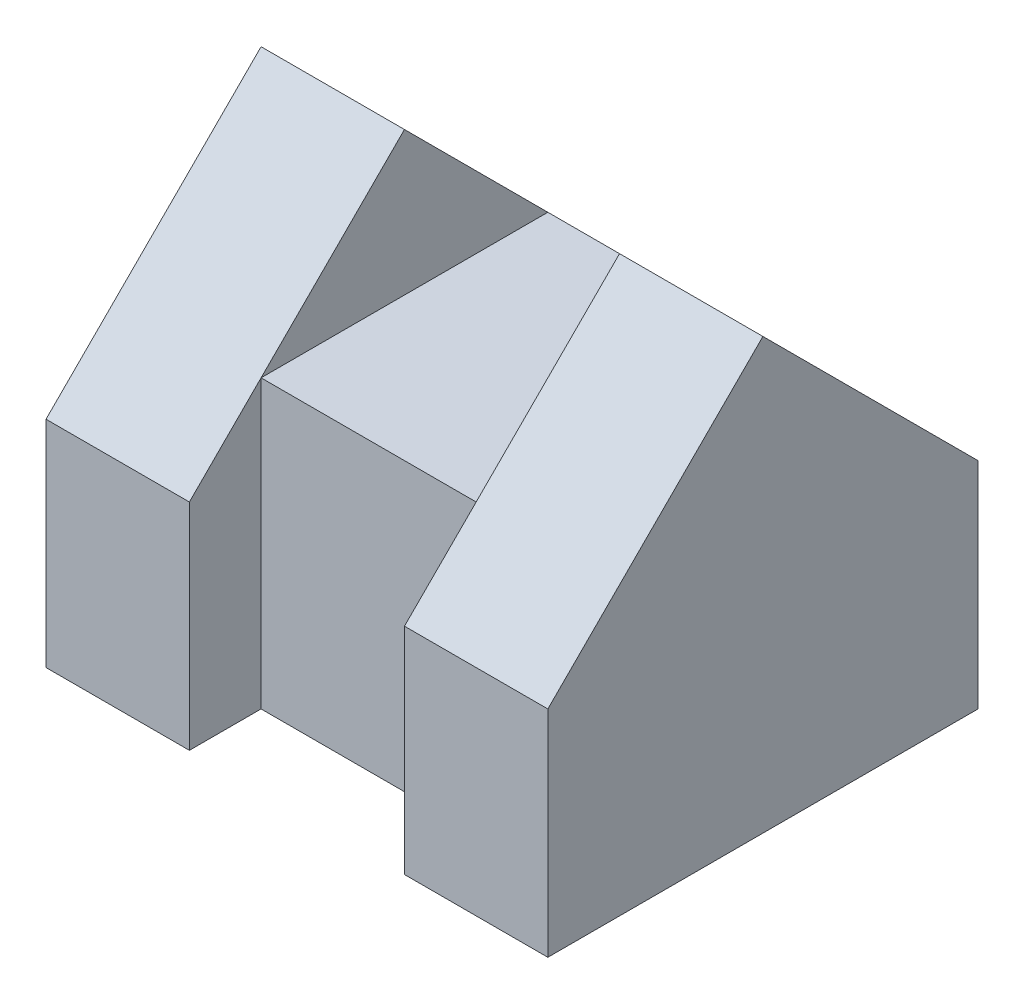
from build123d import *

# Parameters (mm, degrees)
SKETCH2_W           = 177.8
SKETCH2_H           = 152.4
BOSS_EXTRUDE1_DEPTH = 76.2
SKETCH10_W          = 76.2
SKETCH10_H          = 50.8
CUT_EXTRUDE2_DEPTH  = 193.18587357
SKETCH12_W          = 76.2
SKETCH12_H          = 25.4
CUT_EXTRUDE3_DEPTH  = 156.02325632
CUT_EXTRUDE4_DEPTH  = 208.907960406


with BuildPart() as part:
    # Sketch2 → Boss-Extrude1 (new, symmetric)
    with BuildSketch(Plane.XY):
        Rectangle(SKETCH2_W, SKETCH2_H)
    extrude(amount=BOSS_EXTRUDE1_DEPTH, both=True)

    # Sketch10 → Cut-Extrude2 (cut, through all)
    with BuildSketch(Plane.XY.offset(76.2)):
        with Locations((0, 50.8)):
            Rectangle(SKETCH10_W, SKETCH10_H)
    extrude(amount=-CUT_EXTRUDE2_DEPTH, mode=Mode.SUBTRACT)

    # Sketch12 → Cut-Extrude3 (cut, through all)
    with BuildSketch(Plane(origin=(0, 25.4, 0), x_dir=(1, 0, 0), z_dir=(0, 1, 0))):
        with Locations((0, -63.5)):
            Rectangle(SKETCH12_W, SKETCH12_H)
        with Locations((0, 63.5)):
            Rectangle(SKETCH12_W, SKETCH12_H)
    extrude(amount=-CUT_EXTRUDE3_DEPTH, mode=Mode.SUBTRACT)

    # Sketch13 → Cut-Extrude4 (cut, through all)
    with BuildSketch(Plane(origin=(88.9, 0, 0), x_dir=(0, 0, -1), z_dir=(1, 0, 0))):
        Polygon((76.2, 76.2), (0, 76.2), (76.2, 0), align=None)
        Polygon((-76.2, 76.2), (-76.2, 0), (0, 76.2), align=None)
    extrude(amount=-CUT_EXTRUDE4_DEPTH, mode=Mode.SUBTRACT)


solid = part.part
